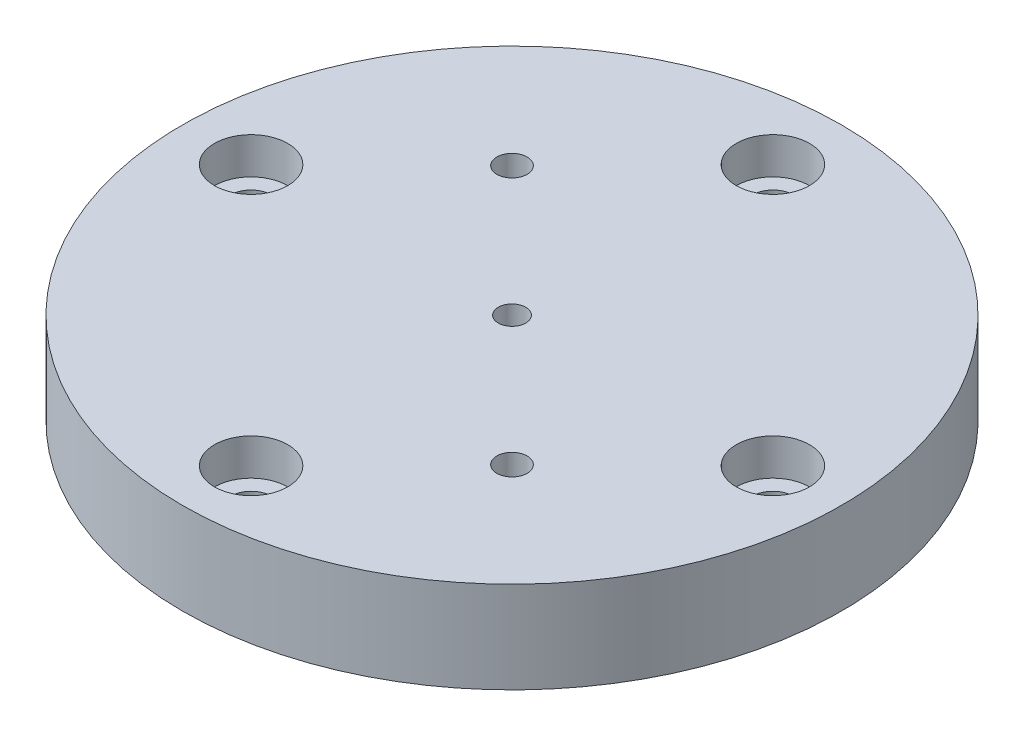
from build123d import *

# Parameters (mm, degrees)
CBORE_FOR_M4_SHCS1_D           = 4.5
CBORE_FOR_M4_SHCS1_CBORE_D     = 8
CBORE_FOR_M4_SHCS1_CBORE_DEPTH = 4
M4X0_7_TAPPED_HOLE1_D          = 3.3
M4X0_7_TAPPED_HOLE1_DEPTH      = 8.1
M4X0_7_TAPPED_HOLE1_TIP        = 0.991420021
SKETCH7_R                      = 1.5
CUT_EXTRUDE1_DEPTH             = 52.884487084


with BuildPart() as part:
    # Sketch2 → Revolve1 (revolve)
    with BuildSketch(Plane.XY, mode=Mode.PRIVATE) as revolve1_sk:
        Polygon((0, 0), (32, 0), (32, -4), (36, -4), (36, 6), (0, 6), align=None)
    revolve(revolve1_sk.sketch.rotate(Axis((0, -990.217396251, 0), (0, 1, 0)), 90), axis=Axis((0, -990.217396251, 0), (0, 1, 0)))

    # CBORE for M4 SHCS1 (through all)
    with Locations(Plane(origin=(0, 6, 0), x_dir=(1, 0, 0), z_dir=(0, 1, 0))):
        with Locations((0, 28.5), (-28.5, 0), (28.5, 0), (0, -28.5)):
            CounterBoreHole(CBORE_FOR_M4_SHCS1_D / 2, CBORE_FOR_M4_SHCS1_CBORE_D / 2, CBORE_FOR_M4_SHCS1_CBORE_DEPTH)

    # M4x0.7 Tapped Hole1
    with Locations(Plane(origin=(0, 6, 0), x_dir=(1, 0, 0), z_dir=(0, 1, 0))):
        with Locations((-14.142135624, 14.142135624), (14.142135624, -14.142135624)):
            Hole(M4X0_7_TAPPED_HOLE1_D / 2, depth=M4X0_7_TAPPED_HOLE1_DEPTH)
            with Locations((0, 0, -(M4X0_7_TAPPED_HOLE1_DEPTH + M4X0_7_TAPPED_HOLE1_TIP / 2))):  # 118° drill point
                Cone(0, M4X0_7_TAPPED_HOLE1_D / 2, M4X0_7_TAPPED_HOLE1_TIP, mode=Mode.SUBTRACT)

    # Sketch7 → Cut-Extrude1 (cut, through all)
    with BuildSketch(Plane(origin=(0, 6, 0), x_dir=(1, 0, 0), z_dir=(0, 1, 0))):
        with Locations(Location((0, 0, 0), (0, 0, 270))):
            Circle(SKETCH7_R)
    extrude(amount=-CUT_EXTRUDE1_DEPTH, mode=Mode.SUBTRACT)


solid = part.part
